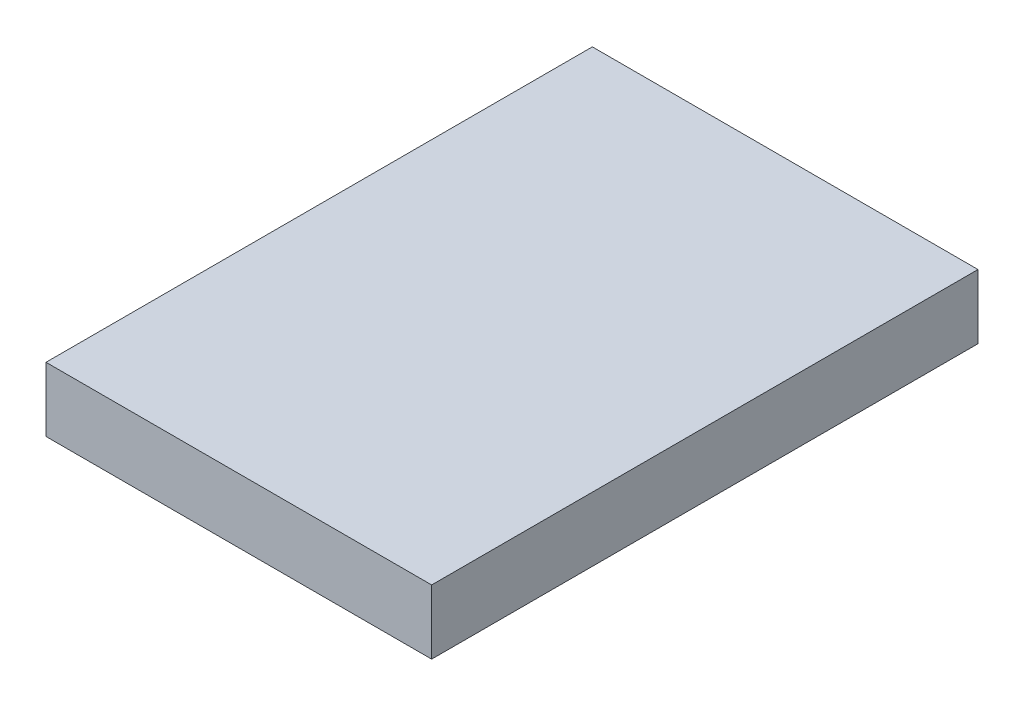
from build123d import *

# Parameters (mm, degrees)
SKETCH1_W           = 60
SKETCH1_H           = 10
BOSS_EXTRUDE1_DEPTH = 85


with BuildPart() as part:
    # Sketch1 → Boss-Extrude1 (new body)
    with BuildSketch(Plane.XY):
        Rectangle(SKETCH1_W, SKETCH1_H)
    extrude(amount=BOSS_EXTRUDE1_DEPTH)


solid = part.part
